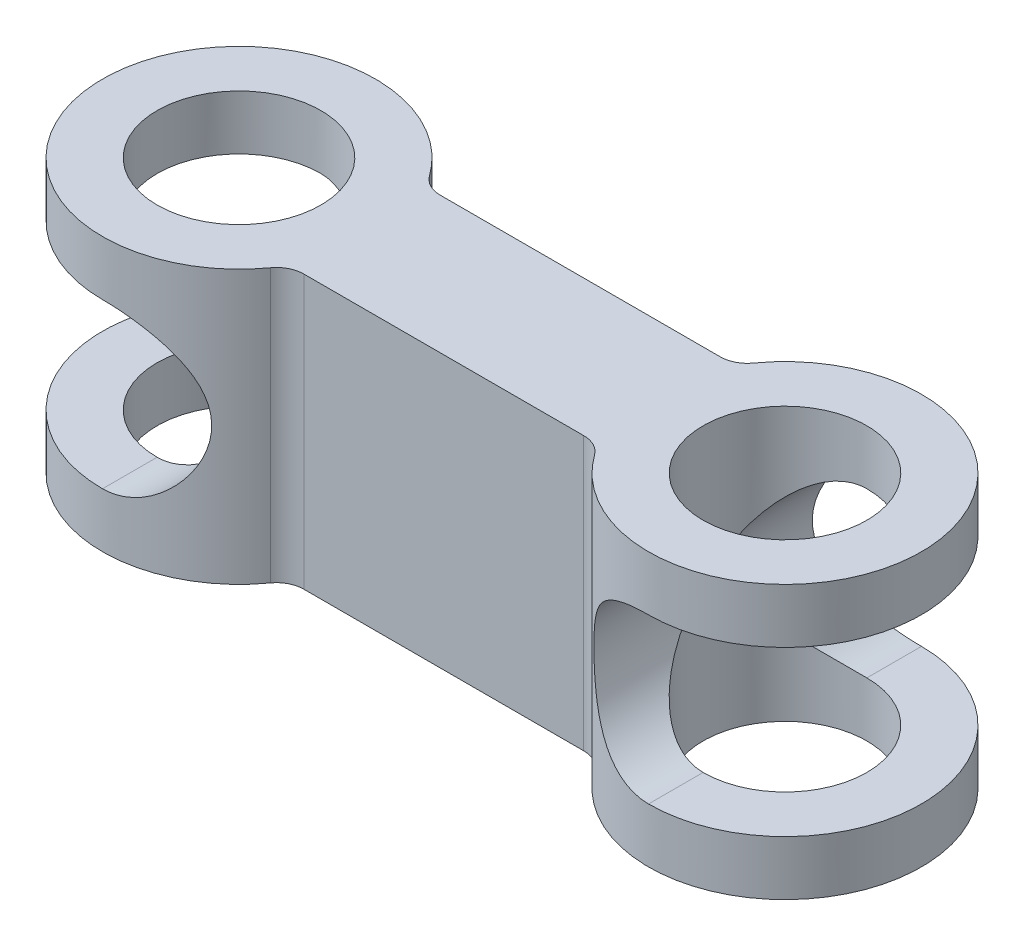
from build123d import *

# Parameters (mm, degrees)
SKETCH1_W            = 10
SKETCH1_H            = 5
BOSS_EXTRUDE1_DEPTH  = 10
SKETCH2_R            = 5
BOSS_EXTRUDE2_DEPTH  = 10
CUT_EXTRUDE1_REACH   = 17
SKETCH3_R            = 3
CUT_EXTRUDE2_DEPTH   = 16
FILLET1_R            = 1
FILLET1_OF_MIRROR1_R = 1


with BuildPart() as part:
    # Sketch1 → Boss-Extrude1 (new body)
    with BuildSketch(Plane(origin=(0, 0, 0), x_dir=(1, 0, 0), z_dir=(0, 1, 0))):
        with Locations((5, 0)):
            Rectangle(SKETCH1_W, SKETCH1_H)
    boss_extrude1 = extrude(amount=BOSS_EXTRUDE1_DEPTH)

    # Sketch2 → Boss-Extrude2 (add)
    with BuildSketch(Plane(origin=(0, 0, 0), x_dir=(1, 0, 0), z_dir=(0, 1, 0))):
        Circle(SKETCH2_R)
    boss_extrude2 = extrude(amount=BOSS_EXTRUDE2_DEPTH)

    # Sketch3 → Cut-Extrude1 (cut, up to next)
    with BuildSketch(Plane(origin=(0, 0, 0), x_dir=(1, 0, 0), z_dir=(0, 1, 0)), mode=Mode.PRIVATE) as cut_extrude1_sk1:
        with Locations(Location((0, 0, 0), (0, 0, 270))):
            Circle(SKETCH3_R)
    cut_extrude1_tool1 = extrude(cut_extrude1_sk1.sketch, amount=CUT_EXTRUDE1_REACH, mode=Mode.PRIVATE) & part.part
    cut_extrude1 = cut_extrude1_tool1.solids().sort_by_distance((0, 0, 0))[0]
    add(cut_extrude1, mode=Mode.SUBTRACT)

    # Sketch4 → Cut-Extrude2 (cut, symmetric)
    with BuildSketch(Plane.XY):
        with BuildLine():
            Line((0, 8), (-5, 8))
            Line((-5, 8), (-5, 2))
            Line((-5, 2), (0, 2))
            ThreePointArc((0, 2), (3, 5), (0, 8))
        make_face()
    cut_extrude2 = extrude(amount=CUT_EXTRUDE2_DEPTH, both=True, mode=Mode.SUBTRACT)

    # Fillet1
    fillet1_edges = [part.edges().sort_by_distance(p)[0] for p in [
        (4.330127019, 5, 2.5),
        (4.330127019, 5, -2.5),
    ]]
    fillet(fillet1_edges, radius=FILLET1_R)

    # Mirror1: Boss-Extrude1, Boss-Extrude2, Cut-Extrude1, Cut-Extrude2 across plane
    add(boss_extrude1.mirror(Plane(origin=(10, 10, -2.5), x_dir=(0, 0, 1), z_dir=(-1, 0, 0))))
    add(boss_extrude2.mirror(Plane(origin=(10, 10, -2.5), x_dir=(0, 0, 1), z_dir=(-1, 0, 0))))
    add(cut_extrude1.mirror(Plane(origin=(10, 10, -2.5), x_dir=(0, 0, 1), z_dir=(-1, 0, 0))), mode=Mode.SUBTRACT)
    add(cut_extrude2.mirror(Plane(origin=(10, 10, -2.5), x_dir=(0, 0, 1), z_dir=(-1, 0, 0))), mode=Mode.SUBTRACT)

    # Fillet1 of Mirror1
    fillet1_of_mirror1_edges = [part.edges().sort_by_distance(p)[0] for p in [
        (15.669872981, 5, 2.5),
        (15.669872981, 5, -2.5),
    ]]
    fillet(fillet1_of_mirror1_edges, radius=FILLET1_OF_MIRROR1_R)


solid = part.part
